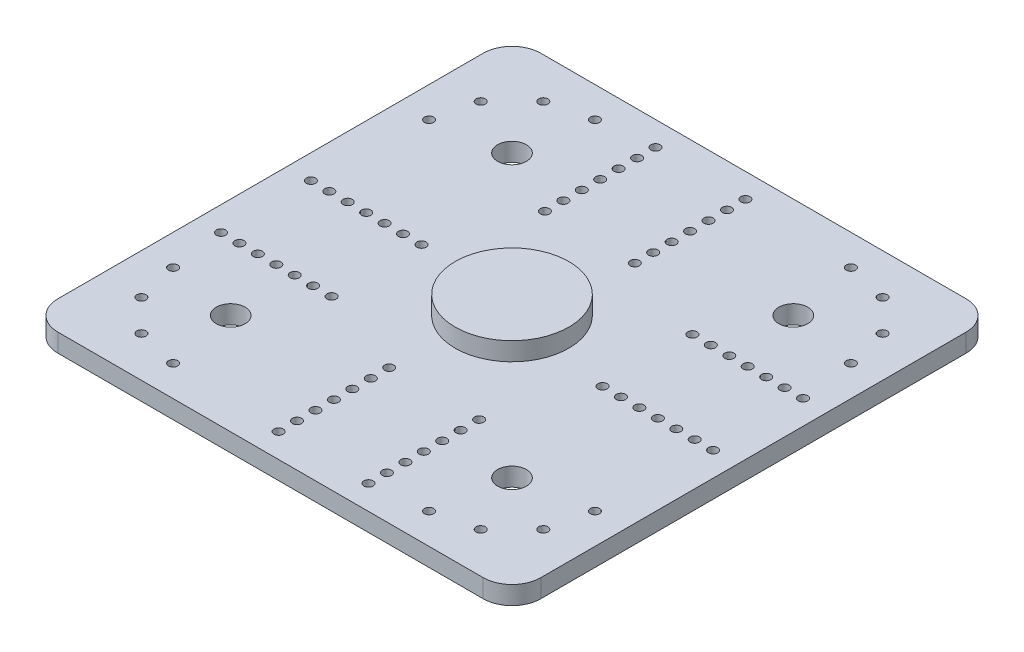
from build123d import *

# Parameters (mm, degrees)
SKETCH1_W           = 167.64
SKETCH1_H           = 167.64
BOSS_EXTRUDE1_DEPTH = 6.35
SKETCH2_R           = 19.725818268
BOSS_EXTRUDE2_DEPTH = 6.35
SKETCH3_R           = 1.6
CUT_EXTRUDE1_DEPTH  = 10
SKETCH5_R           = 1.6
CUT_EXTRUDE3_DEPTH  = 119.709339565
CIRPATTERN2_COUNT   = 4
SKETCH6_R           = 1.6
CUT_EXTRUDE4_DEPTH  = 119.709339565
CIRPATTERN3_COUNT   = 4
SKETCH7_R           = 5
CUT_EXTRUDE5_DEPTH  = 119.709339565
CIRPATTERN4_COUNT   = 4
FILLET1_R           = 10


with BuildPart() as part:
    # Sketch1 → Boss-Extrude1 (new body)
    with BuildSketch(Plane(origin=(0, 0, 0), x_dir=(1, 0, 0), z_dir=(0, 1, 0))):
        Rectangle(SKETCH1_W, SKETCH1_H)
    extrude(amount=BOSS_EXTRUDE1_DEPTH)

    # Sketch2 → Boss-Extrude2 (add)
    with BuildSketch(Plane(origin=(0, 6.35, 0), x_dir=(1, 0, 0), z_dir=(0, 1, 0))):
        with Locations(Location((0, 0, 0), (0, 0, 270))):
            Circle(SKETCH2_R)
    extrude(amount=BOSS_EXTRUDE2_DEPTH)

    # Sketch3 → Cut-Extrude1 (cut)
    with BuildSketch(Plane(origin=(0, 6.35, 0), x_dir=(1, 0, 0), z_dir=(0, 1, 0))):
        with Locations(Location((5.59999998, 75.42, 0), (0, 0, 270))):
            Circle(SKETCH3_R)
        with Locations(Location((-25.60000002, 75.42, 0), (0, 0, 270))):
            Circle(SKETCH3_R)
        with Locations(Location((5.59999998, 69.02, 0), (0, 0, 270))):
            Circle(SKETCH3_R)
        with Locations(Location((-25.60000002, 69.02, 0), (0, 0, 270))):
            Circle(SKETCH3_R)
        with Locations(Location((5.59999998, 62.62, 0), (0, 0, 270))):
            Circle(SKETCH3_R)
        with Locations(Location((-25.60000002, 62.62, 0), (0, 0, 270))):
            Circle(SKETCH3_R)
        with Locations(Location((5.59999998, 56.22, 0), (0, 0, 270))):
            Circle(SKETCH3_R)
        with Locations(Location((-25.60000002, 56.22, 0), (0, 0, 270))):
            Circle(SKETCH3_R)
        with Locations(Location((5.59999998, 49.82, 0), (0, 0, 270))):
            Circle(SKETCH3_R)
        with Locations(Location((-25.60000002, 49.82, 0), (0, 0, 270))):
            Circle(SKETCH3_R)
        with Locations(Location((5.59999998, 43.42, 0), (0, 0, 270))):
            Circle(SKETCH3_R)
        with Locations(Location((-25.60000002, 43.42, 0), (0, 0, 270))):
            Circle(SKETCH3_R)
        with Locations(Location((5.59999998, 37.02, 0), (0, 0, 270))):
            Circle(SKETCH3_R)
        with Locations(Location((-25.60000002, 37.02, 0), (0, 0, 270))):
            Circle(SKETCH3_R)
        with Locations(Location((75.42, -5.59999998, 0), (0, 0, 270))):
            Circle(SKETCH3_R)
        with Locations(Location((75.42, 25.60000002, 0), (0, 0, 270))):
            Circle(SKETCH3_R)
        with Locations(Location((69.02, -5.59999998, 0), (0, 0, 270))):
            Circle(SKETCH3_R)
        with Locations(Location((62.62, -5.59999998, 0), (0, 0, 270))):
            Circle(SKETCH3_R)
        with Locations(Location((56.22, -5.59999998, 0), (0, 0, 270))):
            Circle(SKETCH3_R)
        with Locations(Location((49.82, -5.59999998, 0), (0, 0, 270))):
            Circle(SKETCH3_R)
        with Locations(Location((43.42, -5.59999998, 0), (0, 0, 270))):
            Circle(SKETCH3_R)
        with Locations(Location((37.02, -5.59999998, 0), (0, 0, 270))):
            Circle(SKETCH3_R)
        with Locations(Location((69.02, 25.60000002, 0), (0, 0, 270))):
            Circle(SKETCH3_R)
        with Locations(Location((62.62, 25.60000002, 0), (0, 0, 270))):
            Circle(SKETCH3_R)
        with Locations(Location((56.22, 25.60000002, 0), (0, 0, 270))):
            Circle(SKETCH3_R)
        with Locations(Location((49.82, 25.60000002, 0), (0, 0, 270))):
            Circle(SKETCH3_R)
        with Locations(Location((43.42, 25.60000002, 0), (0, 0, 270))):
            Circle(SKETCH3_R)
        with Locations(Location((37.02, 25.60000002, 0), (0, 0, 270))):
            Circle(SKETCH3_R)
        with Locations(Location((-5.59999998, -75.42, 0), (0, 0, 270))):
            Circle(SKETCH3_R)
        with Locations(Location((25.60000002, -75.42, 0), (0, 0, 270))):
            Circle(SKETCH3_R)
        with Locations(Location((-5.59999998, -69.02, 0), (0, 0, 270))):
            Circle(SKETCH3_R)
        with Locations(Location((-5.59999998, -62.62, 0), (0, 0, 270))):
            Circle(SKETCH3_R)
        with Locations(Location((-5.59999998, -56.22, 0), (0, 0, 270))):
            Circle(SKETCH3_R)
        with Locations(Location((-5.59999998, -49.82, 0), (0, 0, 270))):
            Circle(SKETCH3_R)
        with Locations(Location((-5.59999998, -43.42, 0), (0, 0, 270))):
            Circle(SKETCH3_R)
        with Locations(Location((-5.59999998, -37.02, 0), (0, 0, 270))):
            Circle(SKETCH3_R)
        with Locations(Location((25.60000002, -69.02, 0), (0, 0, 270))):
            Circle(SKETCH3_R)
        with Locations(Location((25.60000002, -62.62, 0), (0, 0, 270))):
            Circle(SKETCH3_R)
        with Locations(Location((25.60000002, -56.22, 0), (0, 0, 270))):
            Circle(SKETCH3_R)
        with Locations(Location((25.60000002, -49.82, 0), (0, 0, 270))):
            Circle(SKETCH3_R)
        with Locations(Location((25.60000002, -43.42, 0), (0, 0, 270))):
            Circle(SKETCH3_R)
        with Locations(Location((25.60000002, -37.02, 0), (0, 0, 270))):
            Circle(SKETCH3_R)
        with Locations(Location((-75.42, 5.59999998, 0), (0, 0, 270))):
            Circle(SKETCH3_R)
        with Locations(Location((-75.42, -25.60000002, 0), (0, 0, 270))):
            Circle(SKETCH3_R)
        with Locations(Location((-69.02, 5.59999998, 0), (0, 0, 270))):
            Circle(SKETCH3_R)
        with Locations(Location((-62.62, 5.59999998, 0), (0, 0, 270))):
            Circle(SKETCH3_R)
        with Locations(Location((-56.22, 5.59999998, 0), (0, 0, 270))):
            Circle(SKETCH3_R)
        with Locations(Location((-49.82, 5.59999998, 0), (0, 0, 270))):
            Circle(SKETCH3_R)
        with Locations(Location((-43.42, 5.59999998, 0), (0, 0, 270))):
            Circle(SKETCH3_R)
        with Locations(Location((-37.02, 5.59999998, 0), (0, 0, 270))):
            Circle(SKETCH3_R)
        with Locations(Location((-69.02, -25.60000002, 0), (0, 0, 270))):
            Circle(SKETCH3_R)
        with Locations(Location((-62.62, -25.60000002, 0), (0, 0, 270))):
            Circle(SKETCH3_R)
        with Locations(Location((-56.22, -25.60000002, 0), (0, 0, 270))):
            Circle(SKETCH3_R)
        with Locations(Location((-49.82, -25.60000002, 0), (0, 0, 270))):
            Circle(SKETCH3_R)
        with Locations(Location((-43.42, -25.60000002, 0), (0, 0, 270))):
            Circle(SKETCH3_R)
        with Locations(Location((-37.02, -25.60000002, 0), (0, 0, 270))):
            Circle(SKETCH3_R)
    extrude(amount=-CUT_EXTRUDE1_DEPTH, mode=Mode.SUBTRACT)

    # Sketch5 → Cut-Extrude3 (cut, through all)
    with BuildSketch(Plane(origin=(0, 6.35, 0), x_dir=(1, 0, 0), z_dir=(0, 1, 0))):
        with Locations(Location((-69.75, 58.89, 0), (0, 0, 270))):
            Circle(SKETCH5_R)
        with Locations(Location((-58.89, 69.75, 0), (0, 0, 270))):
            Circle(SKETCH5_R)
    cut_extrude3 = extrude(amount=-CUT_EXTRUDE3_DEPTH, mode=Mode.SUBTRACT)

    # CirPattern2: Cut-Extrude3 ×4 about axis
    cirpattern2_axis = Axis((0, 0, 0), (0, 1, 0))
    for i in range(1, CIRPATTERN2_COUNT):
        add(cut_extrude3.rotate(cirpattern2_axis, i * 360 / CIRPATTERN2_COUNT), mode=Mode.SUBTRACT)

    # Sketch6 → Cut-Extrude4 (cut, through all)
    with BuildSketch(Plane(origin=(0, 6.35, 0), x_dir=(1, 0, 0), z_dir=(0, 1, 0))):
        with Locations(Location((-44.426601718, 73.213398282, 0), (0, 0, 270))):
            Circle(SKETCH6_R)
        with Locations(Location((-73.213398282, 44.426601718, 0), (0, 0, 270))):
            Circle(SKETCH6_R)
    cut_extrude4 = extrude(amount=-CUT_EXTRUDE4_DEPTH, mode=Mode.SUBTRACT)

    # CirPattern3: Cut-Extrude4 ×4 about axis
    cirpattern3_axis = Axis((0, 0, 0), (0, 1, 0))
    for i in range(1, CIRPATTERN3_COUNT):
        add(cut_extrude4.rotate(cirpattern3_axis, i * 360 / CIRPATTERN3_COUNT), mode=Mode.SUBTRACT)

    # Sketch7 → Cut-Extrude5 (cut, through all)
    with BuildSketch(Plane(origin=(0, 6.35, 0), x_dir=(1, 0, 0), z_dir=(0, 1, 0))):
        with Locations(Location((48.82, 48.82, 0), (0, 0, 270))):
            Circle(SKETCH7_R)
    cut_extrude5 = extrude(amount=-CUT_EXTRUDE5_DEPTH, mode=Mode.SUBTRACT)

    # CirPattern4: Cut-Extrude5 ×4 about axis
    cirpattern4_axis = Axis((0, 0, 0), (0, 1, 0))
    for i in range(1, CIRPATTERN4_COUNT):
        add(cut_extrude5.rotate(cirpattern4_axis, i * 360 / CIRPATTERN4_COUNT), mode=Mode.SUBTRACT)

    # Fillet1
    fillet1_edges = [part.edges().sort_by_distance(p)[0] for p in [
        (83.82, 3.175, 83.82),
        (-83.82, 3.175, 83.82),
        (-83.82, 3.175, -83.82),
        (83.82, 3.175, -83.82),
    ]]
    fillet(fillet1_edges, radius=FILLET1_R)


solid = part.part
